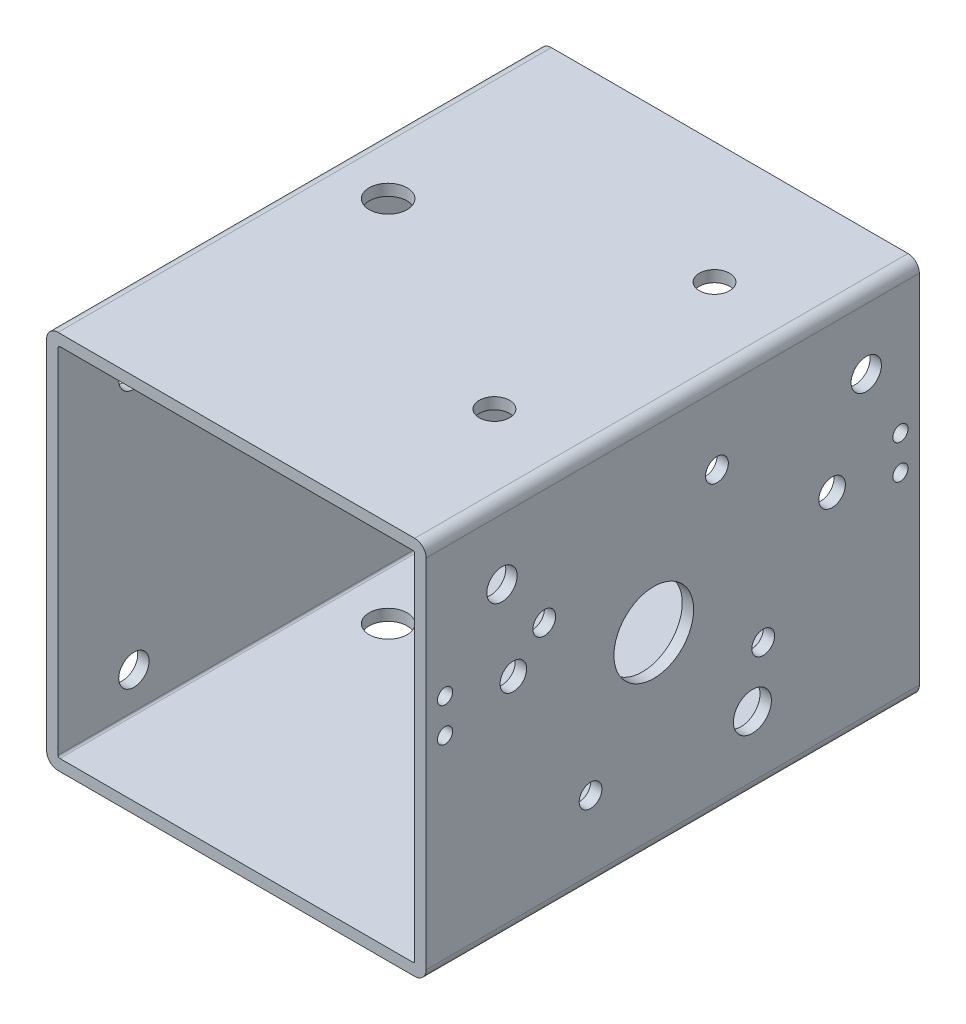
from build123d import *

# Parameters (mm, degrees)
SKETCH1_W                      = 100
SKETCH1_H                      = 100
SKETCH1_W_2                    = 94
SKETCH1_H_2                    = 94
EXTRUDE_THIN1_DEPTH            = 130
FILLET1_R                      = 0.5
FILLET2_R                      = 3
F_8_0_8_DIAMETER_HOLE2_D       = 8
F_8_0_8_DIAMETER_HOLE3_D       = 8
F_10_0_10_DIAMETER_HOLE1_D     = 10
F_10_0_10_DIAMETER_HOLE2_D     = 10
M8X1_25_TAPPED_HOLE1_D         = 6.8
M8X1_25_TAPPED_HOLE1_DEPTH     = 3
M8X1_25_TAPPED_HOLE2_D         = 6.8
M8X1_25_TAPPED_HOLE2_DEPTH     = 3
F_21_0_21_DIAMETER_HOLE1_D     = 21
F_21_0_21_DIAMETER_HOLE1_DEPTH = 3
F_6_0_6_DIAMETER_HOLE1_D       = 6
F_6_0_6_DIAMETER_HOLE1_DEPTH   = 3
CUT_EXTRUDE1_REACH             = 173.464
SKETCH27_R                     = 2
SKETCH27_R_2                   = 3.5
CUT_EXTRUDE2_REACH             = 173.464
SKETCH31_R                     = 4


with BuildPart() as part:
    # Sketch1 → Extrude-Thin1 (new body)
    with BuildSketch(Plane.XY):
        Rectangle(SKETCH1_W, SKETCH1_H)
        Rectangle(SKETCH1_W_2, SKETCH1_H_2, mode=Mode.SUBTRACT)
    extrude(amount=EXTRUDE_THIN1_DEPTH)

    # Fillet1
    fillet1_edges = [part.edges().sort_by_distance(p)[0] for p in [
        (47, -47, 65),
        (47, 47, 65),
        (-47, 47, 65),
        (-47, -47, 65),
    ]]
    fillet(fillet1_edges, radius=FILLET1_R)

    # Fillet2
    fillet2_edges = [part.edges().sort_by_distance(p)[0] for p in [
        (50, -50, 65),
        (-50, -50, 65),
        (-50, 50, 65),
        (50, 50, 65),
    ]]
    fillet(fillet2_edges, radius=FILLET2_R)

    # Ø8.0 (8) Diameter Hole2 (through all)
    with Locations(Plane(origin=(0, 50, 0), x_dir=(1, 0, 0), z_dir=(0, 1, 0))):
        with Locations((28, -32), (28, -90)):
            Hole(F_8_0_8_DIAMETER_HOLE2_D / 2)

    # Ø8.0 (8) Diameter Hole3 (through all)
    with Locations(Plane(origin=(50, 0, 0), x_dir=(0, 0, -1), z_dir=(1, 0, 0))):
        with Locations((-14, 31), (-110, 31)):
            Hole(F_8_0_8_DIAMETER_HOLE3_D / 2)

    # Ø10.0 (10) Diameter Hole1 (through all)
    with Locations(Plane(origin=(0, 50, 0), x_dir=(1, 0, 0), z_dir=(0, 1, 0))):
        with Locations((-34, -56)):
            Hole(F_10_0_10_DIAMETER_HOLE1_D / 2)

    # Ø10.0 (10) Diameter Hole2 (through all)
    with Locations(Plane(origin=(50, 0, 0), x_dir=(0, 0, -1), z_dir=(1, 0, 0))):
        with Locations((-44, -31)):
            Hole(F_10_0_10_DIAMETER_HOLE2_D / 2)

    # M8x1.25 Tapped Hole1
    with Locations(Plane.ZY.offset(50)):
        with Locations((56, -15), (56, 35)):
            Hole(M8X1_25_TAPPED_HOLE1_D / 2, depth=M8X1_25_TAPPED_HOLE1_DEPTH)

    # M8x1.25 Tapped Hole2
    with Locations(Plane(origin=(0, -50, 0), x_dir=(-1, 0, 0), z_dir=(0, -1, 0))):
        with Locations((20, -44), (-35, -44)):
            Hole(M8X1_25_TAPPED_HOLE2_D / 2, depth=M8X1_25_TAPPED_HOLE2_DEPTH)

    # Ø21.0 (21) Diameter Hole1
    with Locations(Plane(origin=(50, 0, 0), x_dir=(0, 0, -1), z_dir=(1, 0, 0))):
        with Locations((-70, 0)):
            Hole(F_21_0_21_DIAMETER_HOLE1_D / 2, depth=F_21_0_21_DIAMETER_HOLE1_DEPTH)

    # Ø6.0 (6) Diameter Hole1
    with Locations(Plane(origin=(50, 0, 0), x_dir=(0, 0, -1), z_dir=(1, 0, 0))):
        with Locations((-41.157258279, -16.652364697), (-53.347635303, 28.842741721), (-98.842741721, 16.652364697), (-86.652364697, -28.842741721)):
            Hole(F_6_0_6_DIAMETER_HOLE1_D / 2, depth=F_6_0_6_DIAMETER_HOLE1_DEPTH)

    # Sketch27 → Cut-Extrude1 (cut, up to next)
    with BuildSketch(Plane(origin=(50, 0, 0), x_dir=(0, 0, -1), z_dir=(1, 0, 0)), mode=Mode.PRIVATE) as cut_extrude1_sk1:
        with Locations(Location((-5, 13, 0), (0, 0, 90))):
            Circle(SKETCH27_R)
    cut_extrude1_tool1 = extrude(cut_extrude1_sk1.sketch, amount=-CUT_EXTRUDE1_REACH, mode=Mode.PRIVATE) & part.part
    # Sketch27 → Cut-Extrude1 (cut, up to next)
    with BuildSketch(Plane(origin=(50, 0, 0), x_dir=(0, 0, -1), z_dir=(1, 0, 0)), mode=Mode.PRIVATE) as cut_extrude1_sk2:
        with Locations(Location((-5, 4, 0), (0, 0, 90))):
            Circle(SKETCH27_R)
    cut_extrude1_tool2 = extrude(cut_extrude1_sk2.sketch, amount=-CUT_EXTRUDE1_REACH, mode=Mode.PRIVATE) & part.part
    # Sketch27 → Cut-Extrude1 (cut, up to next)
    with BuildSketch(Plane(origin=(50, 0, 0), x_dir=(0, 0, -1), z_dir=(1, 0, 0)), mode=Mode.PRIVATE) as cut_extrude1_sk3:
        with Locations(Location((-23, 8.5, 0), (0, 0, 90))):
            Circle(SKETCH27_R_2)
    cut_extrude1_tool3 = extrude(cut_extrude1_sk3.sketch, amount=-CUT_EXTRUDE1_REACH, mode=Mode.PRIVATE) & part.part
    # Sketch27 → Cut-Extrude1 (cut, up to next)
    with BuildSketch(Plane(origin=(50, 0, 0), x_dir=(0, 0, -1), z_dir=(1, 0, 0)), mode=Mode.PRIVATE) as cut_extrude1_sk4:
        with Locations(Location((-107, 8.5, 0), (0, 0, 270))):
            Circle(SKETCH27_R_2)
    cut_extrude1_tool4 = extrude(cut_extrude1_sk4.sketch, amount=-CUT_EXTRUDE1_REACH, mode=Mode.PRIVATE) & part.part
    # Sketch27 → Cut-Extrude1 (cut, up to next)
    with BuildSketch(Plane(origin=(50, 0, 0), x_dir=(0, 0, -1), z_dir=(1, 0, 0)), mode=Mode.PRIVATE) as cut_extrude1_sk5:
        with Locations(Location((-125, 4, 0), (0, 0, 270))):
            Circle(SKETCH27_R)
    cut_extrude1_tool5 = extrude(cut_extrude1_sk5.sketch, amount=-CUT_EXTRUDE1_REACH, mode=Mode.PRIVATE) & part.part
    # Sketch27 → Cut-Extrude1 (cut, up to next)
    with BuildSketch(Plane(origin=(50, 0, 0), x_dir=(0, 0, -1), z_dir=(1, 0, 0)), mode=Mode.PRIVATE) as cut_extrude1_sk6:
        with Locations(Location((-125, 13, 0), (0, 0, 270))):
            Circle(SKETCH27_R)
    cut_extrude1_tool6 = extrude(cut_extrude1_sk6.sketch, amount=-CUT_EXTRUDE1_REACH, mode=Mode.PRIVATE) & part.part
    add(cut_extrude1_tool1.solids().sort_by_distance((50, 13, 5))[0], mode=Mode.SUBTRACT)
    add(cut_extrude1_tool2.solids().sort_by_distance((50, 4, 5))[0], mode=Mode.SUBTRACT)
    add(cut_extrude1_tool3.solids().sort_by_distance((50, 8.5, 23))[0], mode=Mode.SUBTRACT)
    add(cut_extrude1_tool4.solids().sort_by_distance((50, 8.5, 107))[0], mode=Mode.SUBTRACT)
    add(cut_extrude1_tool5.solids().sort_by_distance((50, 4, 125))[0], mode=Mode.SUBTRACT)
    add(cut_extrude1_tool6.solids().sort_by_distance((50, 13, 125))[0], mode=Mode.SUBTRACT)

    # Sketch31 → Cut-Extrude2 (cut, up to next)
    with BuildSketch(Plane.ZY.offset(50), mode=Mode.PRIVATE) as cut_extrude2_sk1:
        with Locations(Location((14, -37, 0), (0, 0, 270))):
            Circle(SKETCH31_R)
    cut_extrude2_tool1 = extrude(cut_extrude2_sk1.sketch, amount=-CUT_EXTRUDE2_REACH, mode=Mode.PRIVATE) & part.part
    # Sketch31 → Cut-Extrude2 (cut, up to next)
    with BuildSketch(Plane.ZY.offset(50), mode=Mode.PRIVATE) as cut_extrude2_sk2:
        with Locations(Location((110, -37, 0), (0, 0, 270))):
            Circle(SKETCH31_R)
    cut_extrude2_tool2 = extrude(cut_extrude2_sk2.sketch, amount=-CUT_EXTRUDE2_REACH, mode=Mode.PRIVATE) & part.part
    add(cut_extrude2_tool1.solids().sort_by_distance((-50, -37, 14))[0], mode=Mode.SUBTRACT)
    add(cut_extrude2_tool2.solids().sort_by_distance((-50, -37, 110))[0], mode=Mode.SUBTRACT)


solid = part.part
